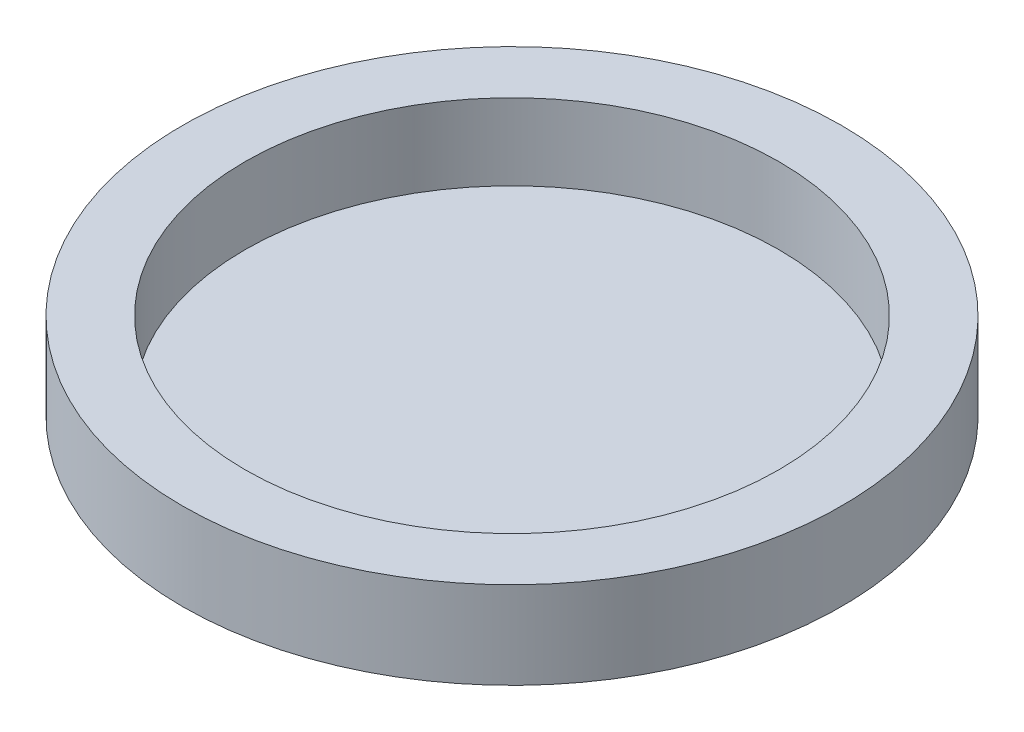
from build123d import *

# Parameters (mm, degrees)
SKETCH1_R           = 30.25
BOSS_EXTRUDE1_DEPTH = 8
SKETCH2_R           = 24.5
CUT_EXTRUDE7_DEPTH  = 7


with BuildPart() as part:
    # Sketch1 → Boss-Extrude1 (new body)
    with BuildSketch(Plane(origin=(0, 0, 0), x_dir=(1, 0, 0), z_dir=(0, 1, 0))):
        with Locations(Location((0, 0, 0), (0, 0, 270))):
            Circle(SKETCH1_R)
    extrude(amount=BOSS_EXTRUDE1_DEPTH)

    # Sketch2 → Cut-Extrude7 (cut)
    with BuildSketch(Plane(origin=(0, 8, 0), x_dir=(1, 0, 0), z_dir=(0, 1, 0))):
        with Locations(Location((0, 0, 0), (0, 0, 270))):
            Circle(SKETCH2_R)
    extrude(amount=-CUT_EXTRUDE7_DEPTH, mode=Mode.SUBTRACT)


solid = part.part
